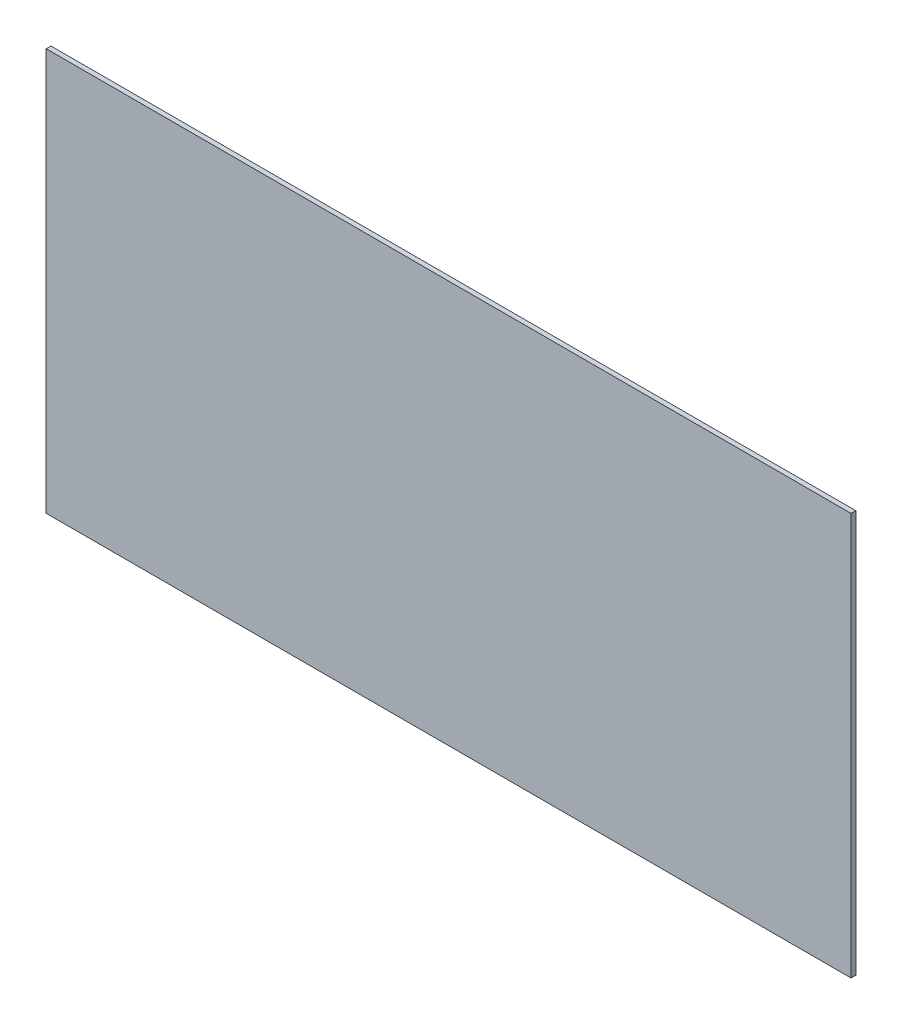
from build123d import *

# Parameters (mm, degrees)
SKETCH1_W           = 340
SKETCH1_H           = 170
BOSS_EXTRUDE1_DEPTH = 2


with BuildPart() as part:
    # Sketch1 → Boss-Extrude1 (new body)
    with BuildSketch(Plane.XY):
        Rectangle(SKETCH1_W, SKETCH1_H)
    extrude(amount=BOSS_EXTRUDE1_DEPTH)


solid = part.part
